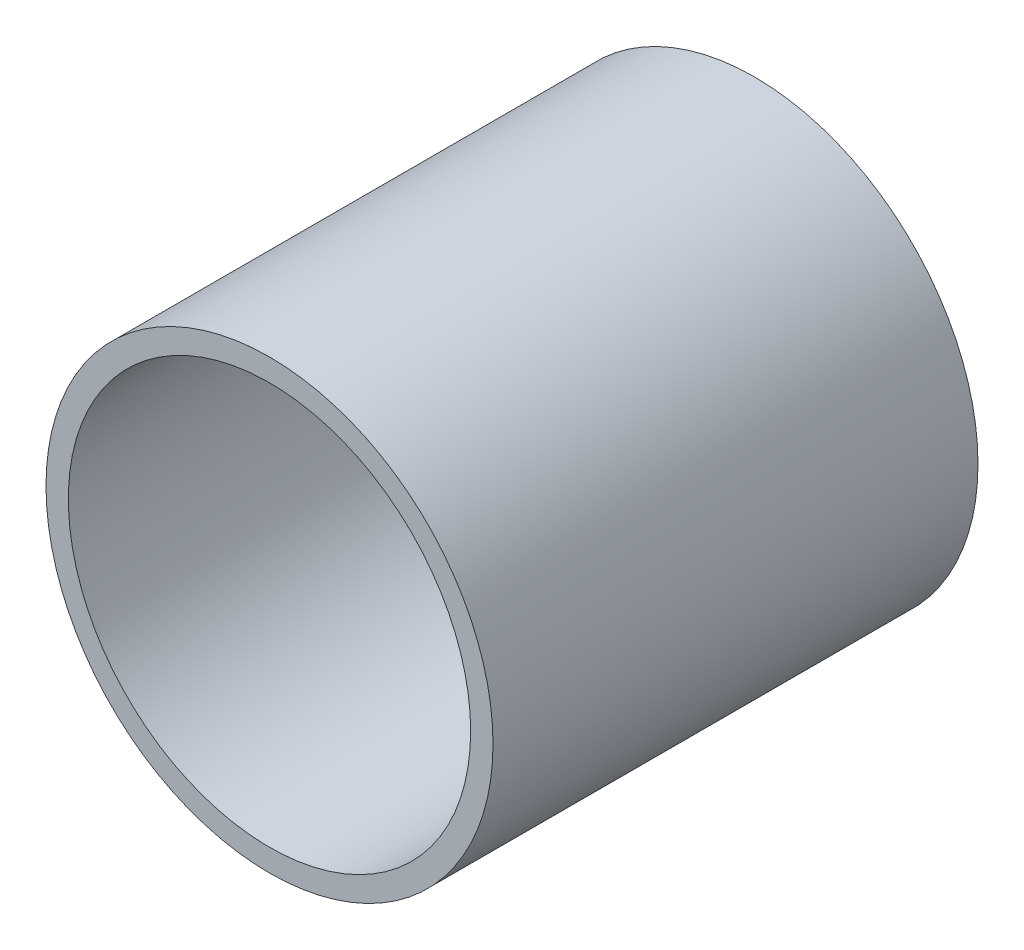
from build123d import *

# Parameters (mm, degrees)
SKETCH1_R           = 100
SKETCH1_R_2         = 90
BOSS_EXTRUDE1_DEPTH = 217


with BuildPart() as part:
    # Sketch1 → Boss-Extrude1 (new body)
    with BuildSketch(Plane.XY):
        Circle(SKETCH1_R)
        Circle(SKETCH1_R_2, mode=Mode.SUBTRACT)
    extrude(amount=BOSS_EXTRUDE1_DEPTH)


solid = part.part
